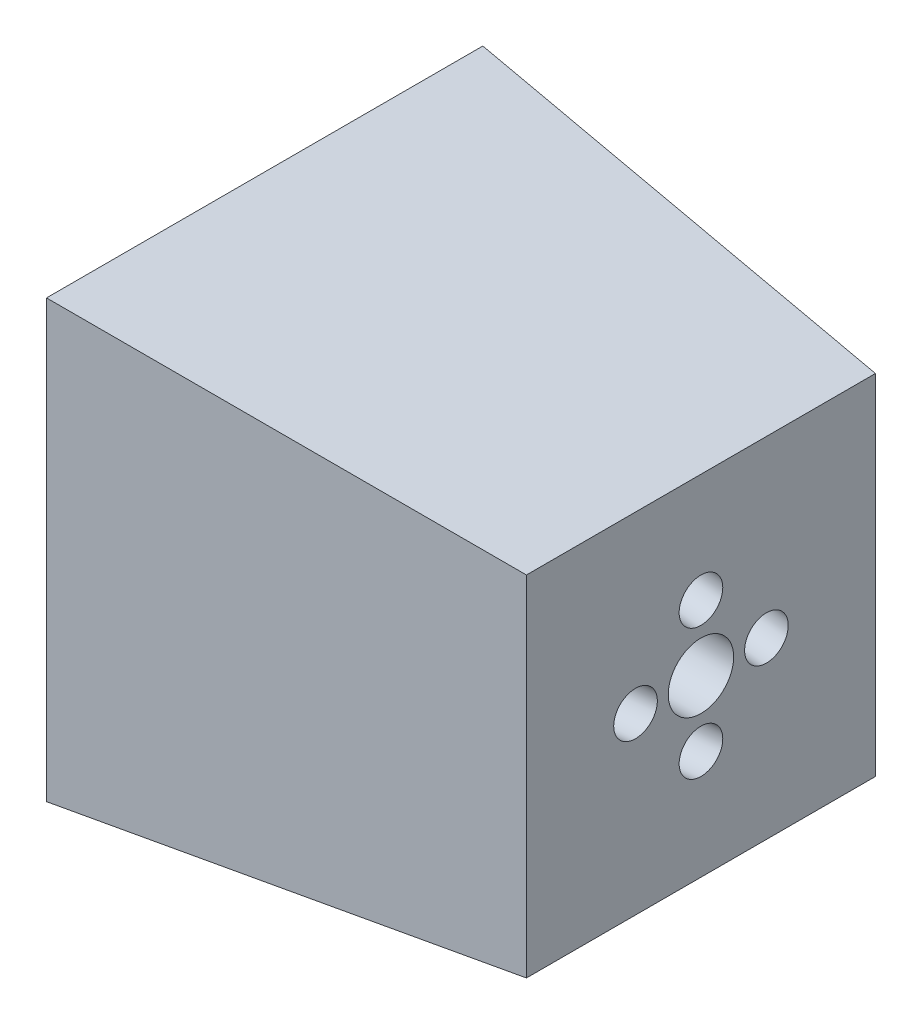
from build123d import *

# Parameters (mm, degrees)
SKETCH3_R          = 5
SKETCH6_R          = 5
SKETCH7_R          = 7.5
CUT_EXTRUDE1_DEPTH = 123.474487302


with BuildPart() as part:
    # Sketch1 → Loft1 section 0
    with BuildSketch(Plane(origin=(0, 0, 0), x_dir=(0, 0, -1), z_dir=(1, 0, 0))):
        with BuildLine():
            Line((40, 40), (-40, 40))
            Line((-40, 40), (-40, -40))
            Line((-40, -40), (40, -40))
            Line((40, -40), (40, 40))
        make_face()
    # Sketch2 → Loft1 section 1
    with BuildSketch(Plane(origin=(-100, 0, 0), x_dir=(0, 0, -1), z_dir=(1, 0, 0))):
        with BuildLine():
            Line((50, 50), (-50, 50))
            Line((-50, 50), (-50, -50))
            Line((-50, -50), (50, -50))
            Line((50, -50), (50, 50))
        make_face()
    loft()

    # Cut-Sweep2: sweep along a path in Sketch4
    with BuildLine(Plane(origin=(0, 0, 0), x_dir=(1, 0, 0), z_dir=(0, 1, 0))) as cut_sweep2_path:
        Line((0, 15), (-100, 25))
    # Sketch3 → Cut-Sweep2 (sweep, cut)
    with BuildSketch(Plane(origin=(0, 0, 0), x_dir=(0, 0, -1), z_dir=(1, 0, 0))):
        with Locations((15, 0)):
            Circle(SKETCH3_R)
    cut_sweep2 = sweep(path=cut_sweep2_path.line, mode=Mode.SUBTRACT)

    # Cut-Sweep3: sweep along a path in Sketch5
    with BuildLine(Plane.XY) as cut_sweep3_path:
        Line((0, 15), (-100, 25))
    # Sketch6 → Cut-Sweep3 (sweep, cut)
    with BuildSketch(Plane(origin=(0, 0, 0), x_dir=(0, 0, -1), z_dir=(1, 0, 0))):
        with Locations((0, 15)):
            Circle(SKETCH6_R)
    cut_sweep3 = sweep(path=cut_sweep3_path.line, mode=Mode.SUBTRACT)

    # Mirror1: Cut-Sweep2 across plane
    add(cut_sweep2.mirror(Plane.XY), mode=Mode.SUBTRACT)

    # Mirror2: Cut-Sweep3 across plane
    add(cut_sweep3.mirror(Plane.ZX), mode=Mode.SUBTRACT)

    # Sketch7 → Cut-Extrude1 (cut, through all)
    with BuildSketch(Plane(origin=(0, 0, 0), x_dir=(0, 0, -1), z_dir=(1, 0, 0))):
        Circle(SKETCH7_R)
    extrude(amount=-CUT_EXTRUDE1_DEPTH, mode=Mode.SUBTRACT)


solid = part.part
